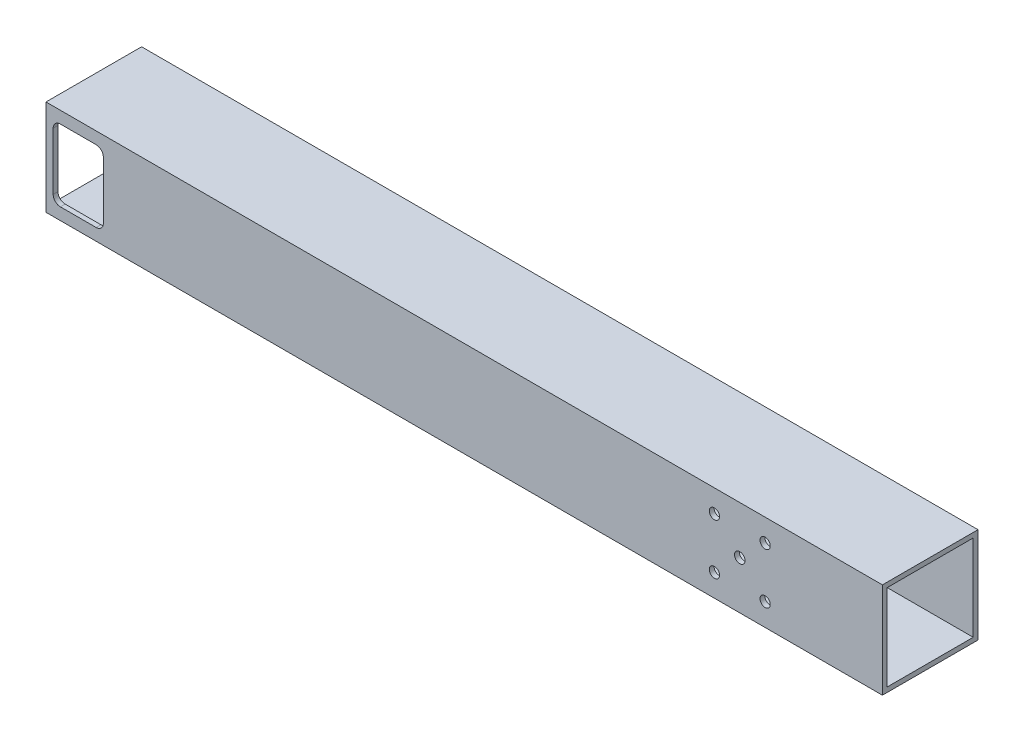
from build123d import *

# Parameters (mm, degrees)
SKETCH1_W                      = 40
SKETCH1_H                      = 40
SKETCH1_W_2                    = 36
SKETCH1_H_2                    = 36
BOSS_EXTRUDE1_DEPTH            = 350
M4_CLEARANCE_HOLE1_D           = 4.3
M4_CLEARANCE_HOLE1_DEPTH       = 2
M4_CLEARANCE_HOLE1_TIP         = 1.291850331
SKETCH5_W                      = 35
SKETCH5_H                      = 35
CUT_EXTRUDE1_DEPTH             = 2
F_4_4_4_4_DIAMETER_HOLE1_D     = 4.4
M3_CLEARANCE_HOLE1_D           = 3.4
M3_CLEARANCE_HOLE1_DEPTH       = 20
M3_CLEARANCE_HOLE1_TIP         = 1.021463052
CUT_EXTRUDE2_REACH             = 356.542
CUT_EXTRUDE2_DIRECTION_2_DEPTH = 355.541958025


with BuildPart() as part:
    # Sketch1 → Boss-Extrude1 (new body)
    with BuildSketch(Plane(origin=(0, 0, 0), x_dir=(0, 0, -1), z_dir=(1, 0, 0))):
        with Locations((20, 20)):
            Rectangle(SKETCH1_W, SKETCH1_H)
        with Locations((20, 20)):
            Rectangle(SKETCH1_W_2, SKETCH1_H_2, mode=Mode.SUBTRACT)
    extrude(amount=BOSS_EXTRUDE1_DEPTH)

    # M4 Clearance Hole1
    with Locations(Plane.XY):
        with Locations((279.706395966, 30.606601718), (300.919599401, 30.606601718), (300.919599401, 9.393398282), (279.706395966, 9.393398282)):
            Hole(M4_CLEARANCE_HOLE1_D / 2, depth=M4_CLEARANCE_HOLE1_DEPTH)
            with Locations((0, 0, -(M4_CLEARANCE_HOLE1_DEPTH + M4_CLEARANCE_HOLE1_TIP / 2))):  # 118° drill point
                Cone(0, M4_CLEARANCE_HOLE1_D / 2, M4_CLEARANCE_HOLE1_TIP, mode=Mode.SUBTRACT)

    # Sketch5 → Cut-Extrude1 (cut)
    with BuildSketch(Plane(origin=(0, 0, -40), x_dir=(-1, 0, 0), z_dir=(0, 0, -1))):
        with Locations((-290.312997684, 20)):
            Rectangle(SKETCH5_W, SKETCH5_H)
    extrude(amount=-CUT_EXTRUDE1_DEPTH, mode=Mode.SUBTRACT)

    # Ø4.4 (4.4) Diameter Hole1 (through all)
    with Locations(Plane(origin=(0, 0, -2), x_dir=(-1, 0, 0), z_dir=(0, 0, -1))):
        with Locations((-290.312997684, 20)):
            Hole(F_4_4_4_4_DIAMETER_HOLE1_D / 2)

    # M3 Clearance Hole1
    with Locations(Plane.XY.offset(-38)):
        with Locations((6.75, 9), (20.25, 31), (13.5, 31), (6.75, 31), (20.25, 9), (13.5, 9)):
            Hole(M3_CLEARANCE_HOLE1_D / 2, depth=M3_CLEARANCE_HOLE1_DEPTH)
            with Locations((0, 0, -(M3_CLEARANCE_HOLE1_DEPTH + M3_CLEARANCE_HOLE1_TIP / 2))):  # 118° drill point
                Cone(0, M3_CLEARANCE_HOLE1_D / 2, M3_CLEARANCE_HOLE1_TIP, mode=Mode.SUBTRACT)

    # Sketch11 → Cut-Extrude2 (cut, up to next)
    with BuildSketch(Plane.XY, mode=Mode.PRIVATE) as cut_extrude2_sk1:
        with BuildLine():
            Line((6, 35), (21, 35))
            ThreePointArc((21, 35), (23.121320344, 34.121320344), (24, 32))
            Line((24, 32), (24, 8))
            ThreePointArc((24, 8), (23.121320344, 5.878679656), (21, 5))
            Line((21, 5), (6, 5))
            ThreePointArc((6, 5), (3.878679656, 5.878679656), (3, 8))
            Line((3, 8), (3, 32))
            ThreePointArc((3, 32), (3.878679656, 34.121320344), (6, 35))
        make_face()
    cut_extrude2_tool1 = extrude(cut_extrude2_sk1.sketch, amount=-CUT_EXTRUDE2_REACH, mode=Mode.PRIVATE) & part.part
    add(cut_extrude2_tool1.solids().sort_by_distance((13.5, 20, 0))[0], mode=Mode.SUBTRACT)

    # Sketch11 → Cut-Extrude2 direction 2 (cut)
    with BuildSketch(Plane.XY):
        with BuildLine():
            Line((6, 35), (21, 35))
            ThreePointArc((21, 35), (23.121320344, 34.121320344), (24, 32))
            Line((24, 32), (24, 8))
            ThreePointArc((24, 8), (23.121320344, 5.878679656), (21, 5))
            Line((21, 5), (6, 5))
            ThreePointArc((6, 5), (3.878679656, 5.878679656), (3, 8))
            Line((3, 8), (3, 32))
            ThreePointArc((3, 32), (3.878679656, 34.121320344), (6, 35))
        make_face()
    extrude(amount=CUT_EXTRUDE2_DIRECTION_2_DEPTH, mode=Mode.SUBTRACT)


solid = part.part
